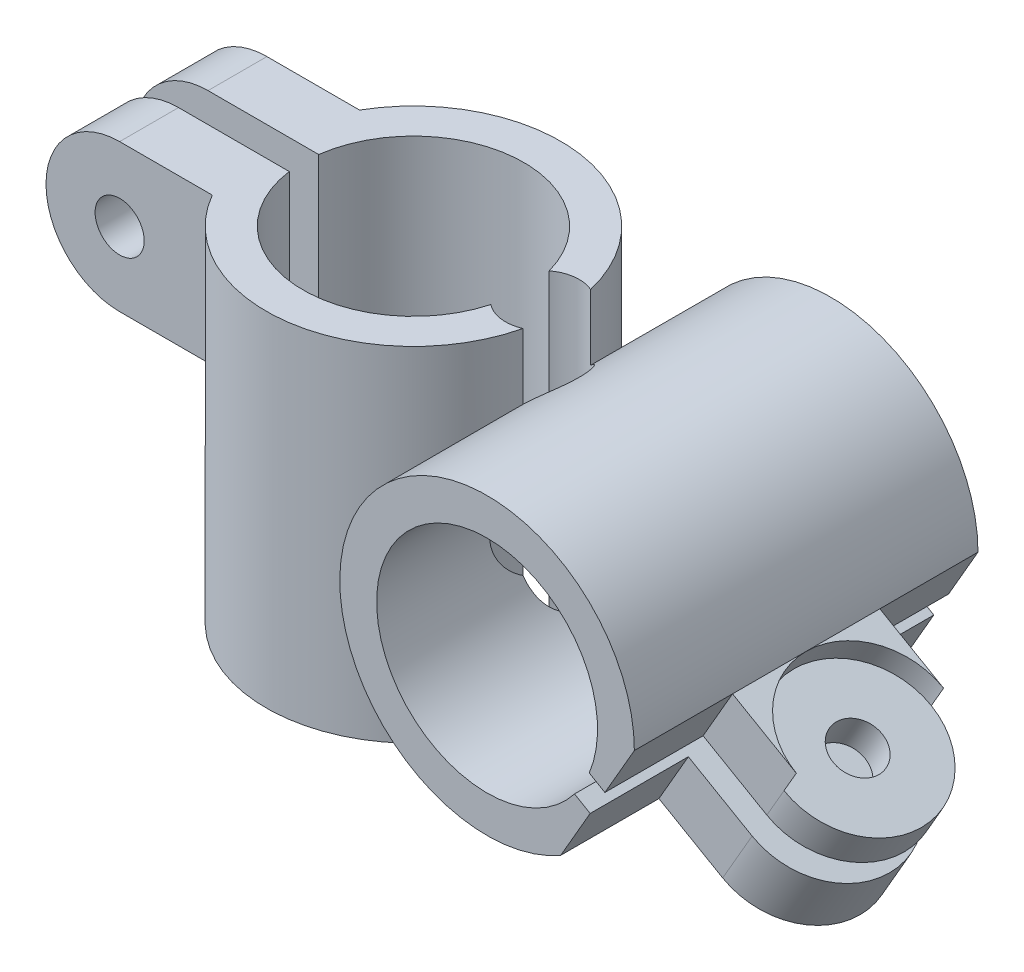
from build123d import *

# Parameters (mm, degrees)
BOSS_EXTRUDE1_DEPTH      = 70
BOSS_EXTRUDE1_2_DEPTH    = 70
SKETCH3_R                = 5
BOSS_EXTRUDE3_DEPTH      = 12
SKETCH4_R                = 5
BOSS_EXTRUDE4_DEPTH      = 12
BOSS_EXTRUDE5_REACH      = 98.366
SKETCH5_W                = 12
SKETCH5_H                = 30
BOSS_EXTRUDE6_REACH      = 98.366
SKETCH6_W                = 12
SKETCH6_H                = 30
BOSS_EXTRUDE7_DEPTH      = 35
BOSS_EXTRUDE7_DEPTH_BACK = 35
SKETCH8_R                = 7.5
CUT_EXTRUDE1_DEPTH       = 132.745671501
CUT_EXTRUDE4_DEPTH       = 122.337535907
CUT_EXTRUDE5_DEPTH       = 122.337535907
SKETCH12_R               = 15
CUT_EXTRUDE6_DEPTH       = 5
SKETCH13_R               = 5
CUT_EXTRUDE7_DEPTH       = 118.019851709


with BuildPart() as part:
    # Sketch2 → Boss-Extrude1 (new body)
    with BuildSketch(Plane(origin=(0, 0, 0), x_dir=(1, 0, 0), z_dir=(0, 1, 0))):
        with BuildLine():
            Line((-29.849623113, 3), (-22.299103121, 3))
            ThreePointArc((-22.299103121, 3), (-1.510093754, 22.449267624), (21.696428571, 5.959445213))
            ThreePointArc((21.696428571, 5.959445213), (25.319689527, 7.44207783), (29.196428571, 6.896996352))
            ThreePointArc((29.196428571, 6.896996352), (-1.975679862, 29.934874128), (-29.849623113, 3))
        make_face()
    extrude(amount=BOSS_EXTRUDE1_DEPTH)

    # Sketch6 → Boss-Extrude6 (add, up to next)
    with BuildSketch(Plane(origin=(-29.849623113, 0, 0), x_dir=(0, 0, -1), z_dir=(1, 0, 0)), mode=Mode.PRIVATE) as boss_extrude6_sk1:
        with Locations((9, 55)):
            Rectangle(SKETCH6_W, SKETCH6_H)
    boss_extrude6_tool1 = extrude(boss_extrude6_sk1.sketch, amount=BOSS_EXTRUDE6_REACH, mode=Mode.PRIVATE) - part.part


with BuildPart() as body_2:
    # Sketch2 → Boss-Extrude1 2 (new body)
    with BuildSketch(Plane(origin=(0, 0, 0), x_dir=(1, 0, 0), z_dir=(0, 1, 0))):
        with BuildLine():
            Line((-29.849623113, -3), (-22.299103121, -3))
            ThreePointArc((-22.299103121, -3), (-1.510093754, -22.449267624), (21.696428571, -5.959445213))
            ThreePointArc((21.696428571, -5.959445213), (25.319689527, -7.44207783), (29.196428571, -6.896996352))
            ThreePointArc((29.196428571, -6.896996352), (-1.975679862, -29.934874128), (-29.849623113, -3))
        make_face()
    extrude(amount=BOSS_EXTRUDE1_2_DEPTH)

    # Sketch5 → Boss-Extrude5 (add, up to next)
    with BuildSketch(Plane(origin=(-29.849623113, 0, 0), x_dir=(0, 0, -1), z_dir=(1, 0, 0)), mode=Mode.PRIVATE) as boss_extrude5_sk1:
        with Locations((-9, 55)):
            Rectangle(SKETCH5_W, SKETCH5_H)
    boss_extrude5_tool1 = extrude(boss_extrude5_sk1.sketch, amount=BOSS_EXTRUDE5_REACH, mode=Mode.PRIVATE) - body_2.part


with BuildPart() as body_3:
    # Sketch3 → Boss-Extrude3 (new body)
    with BuildSketch(Plane.XY.offset(-3)):
        with BuildLine():
            Line((-29.849623113, 70), (-44.849623113, 70))
            ThreePointArc((-44.849623113, 70), (-59.849623113, 55), (-44.849623113, 40))
            Line((-44.849623113, 40), (-29.849623113, 40))
            Line((-29.849623113, 40), (-29.849623113, 70))
        make_face()
        with Locations((-44.849623113, 55)):
            Circle(SKETCH3_R, mode=Mode.SUBTRACT)
    extrude(amount=-BOSS_EXTRUDE3_DEPTH)


with BuildPart() as body_4:
    # Sketch4 → Boss-Extrude4 (new body)
    with BuildSketch(Plane(origin=(0, 0, 3), x_dir=(-1, 0, 0), z_dir=(0, 0, -1))):
        with BuildLine():
            Line((29.849623113, 40), (29.849623113, 70))
            Line((29.849623113, 70), (44.849623113, 70))
            ThreePointArc((44.849623113, 70), (59.849623113, 55), (44.849623113, 40))
            Line((44.849623113, 40), (29.849623113, 40))
        make_face()
        with Locations(Location((44.849623113, 55, 0), (0, 0, 180))):
            Circle(SKETCH4_R, mode=Mode.SUBTRACT)
    extrude(amount=-BOSS_EXTRUDE4_DEPTH)


with BuildPart() as body_2_1:
    add(body_2.part)

    add(body_4.part)  # Boss-Extrude5 merges body 4
    add(boss_extrude5_tool1.solids().sort_by_distance((-29.849623, 55, 9))[0])


with BuildPart() as part_1:
    add(part.part)

    add(body_3.part)  # Boss-Extrude6 merges body 3
    add(boss_extrude6_tool1.solids().sort_by_distance((-29.849623, 55, -9))[0])


    add(body_2_1.part)  # Boss-Extrude7 merges body 2
    # Sketch7 → Boss-Extrude7 (add, two sides: drawn at the far end of the back side and taken through both)
    with BuildSketch(Plane.XY.offset(-BOSS_EXTRUDE7_DEPTH_BACK)):
        with BuildLine():
            Line((99.980762114, 9.607695155), (70.811589784, 26.448524651))
            ThreePointArc((70.811589784, 26.448524651), (30.514428415, 46.25), (67.811589784, 21.252372228))
            Line((67.811589784, 21.252372228), (96.980762114, 4.411542732))
            Line((96.980762114, 4.411542732), (90.980762114, -5.980762114))
            Line((90.980762114, -5.980762114), (65, 9.019237886))
            ThreePointArc((65, 9.019237886), (24.019237886, 50), (80, 35))
            Line((80, 35), (105.980762114, 20))
            Line((105.980762114, 20), (99.980762114, 9.607695155))
        make_face()
    extrude(amount=BOSS_EXTRUDE7_DEPTH + BOSS_EXTRUDE7_DEPTH_BACK)

    # Sketch8 → Cut-Extrude1 (cut, through all)
    with BuildSketch(Plane(origin=(0, 0, 0), x_dir=(1, 0, 0), z_dir=(0, 1, 0))):
        with Locations((26.25, 0)):
            Circle(SKETCH8_R)
    extrude(amount=CUT_EXTRUDE1_DEPTH, mode=Mode.SUBTRACT)

    # Sketch10 → Cut-Extrude4 (cut, through all)
    with BuildSketch(Plane(origin=(35.155444566, 60.891016151, 0), x_dir=(0.8660254037844384, -0.5000000000000007, 0), z_dir=(0.5000000000000006, 0.8660254037844383, 0))):
        with BuildLine():
            Line((66.782032303, 15), (51.782032303, 15))
            Line((51.782032303, 15), (51.782032303, 35))
            Line((51.782032303, 35), (81.782032303, 35))
            Line((81.782032303, 35), (81.782032303, 0))
            ThreePointArc((81.782032303, 0), (77.388634021, 10.606601718), (66.782032303, 15))
        make_face()
    extrude(amount=-CUT_EXTRUDE4_DEPTH, mode=Mode.SUBTRACT)

    # Sketch11 → Cut-Extrude5 (cut, through all)
    with BuildSketch(Plane(origin=(35.155444566, 60.891016151, 0), x_dir=(0.8660254037844384, -0.5000000000000007, 0), z_dir=(0.5000000000000006, 0.8660254037844383, 0))):
        with BuildLine():
            Line((66.782032303, -15), (51.782032303, -15))
            Line((51.782032303, -15), (51.782032303, -35))
            Line((51.782032303, -35), (81.782032303, -35))
            Line((81.782032303, -35), (81.782032303, 0))
            ThreePointArc((81.782032303, 0), (77.388634021, -10.606601718), (66.782032303, -15))
        make_face()
    extrude(amount=-CUT_EXTRUDE5_DEPTH, mode=Mode.SUBTRACT)

    # Sketch12 → Cut-Extrude6 (cut)
    with BuildSketch(Plane(origin=(35.155444566, 60.891016151, 0), x_dir=(0.8660254037844384, -0.5000000000000007, 0), z_dir=(0.5000000000000006, 0.8660254037844383, 0))):
        with Locations((66.782032303, 0)):
            Circle(SKETCH12_R)
    extrude(amount=-CUT_EXTRUDE6_DEPTH, mode=Mode.SUBTRACT)

    # Sketch13 → Cut-Extrude7 (cut, through all)
    with BuildSketch(Plane(origin=(32.655444566, 56.560889132, 0), x_dir=(0.8660254037844383, -0.5000000000000008, 0), z_dir=(0.5000000000000007, 0.8660254037844382, 0))):
        with Locations(Location((66.782032303, 0, 0), (0, 0, 180))):
            Circle(SKETCH13_R)
    extrude(amount=-CUT_EXTRUDE7_DEPTH, mode=Mode.SUBTRACT)


solid = part_1.part
